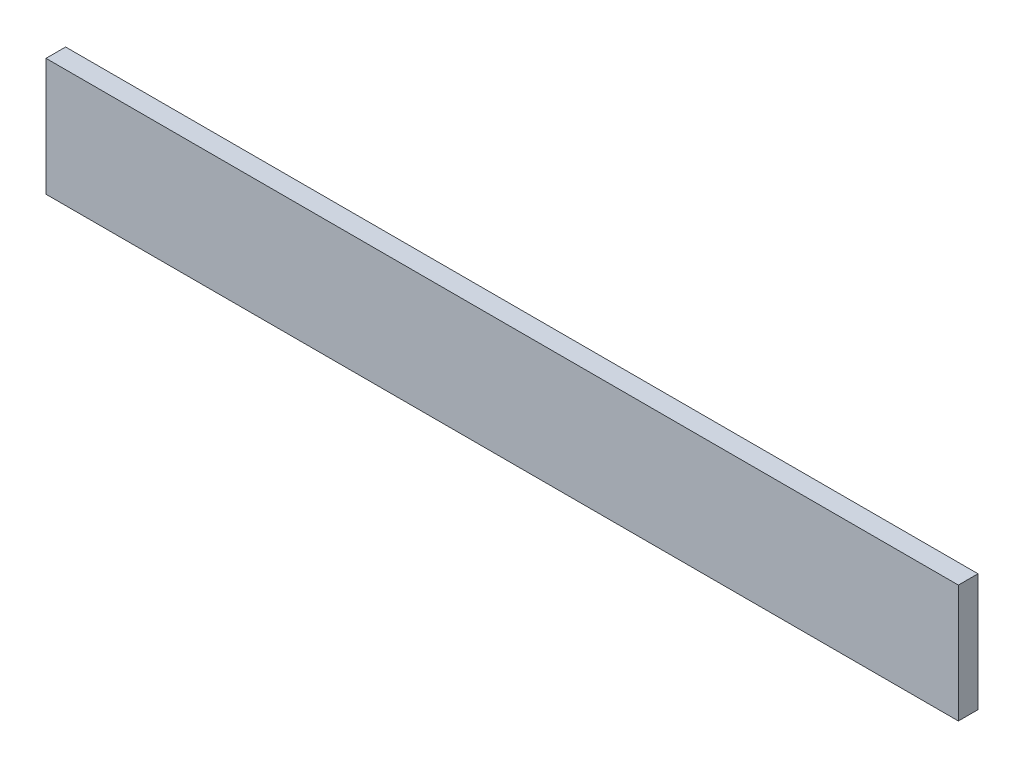
from build123d import *

# Parameters (mm, degrees)
IZIM2_W                     = 465
IZIM2_H                     = 60
Y_KSEKLIK_EKSTR_ZYON1_DEPTH = 10


with BuildPart() as part:
    # Çizim2 → Yükseklik-Ekstrüzyon1 (new body)
    with BuildSketch(Plane.XY):
        with Locations((0, 50.922838117)):
            Rectangle(IZIM2_W, IZIM2_H)
    extrude(amount=Y_KSEKLIK_EKSTR_ZYON1_DEPTH)


solid = part.part
